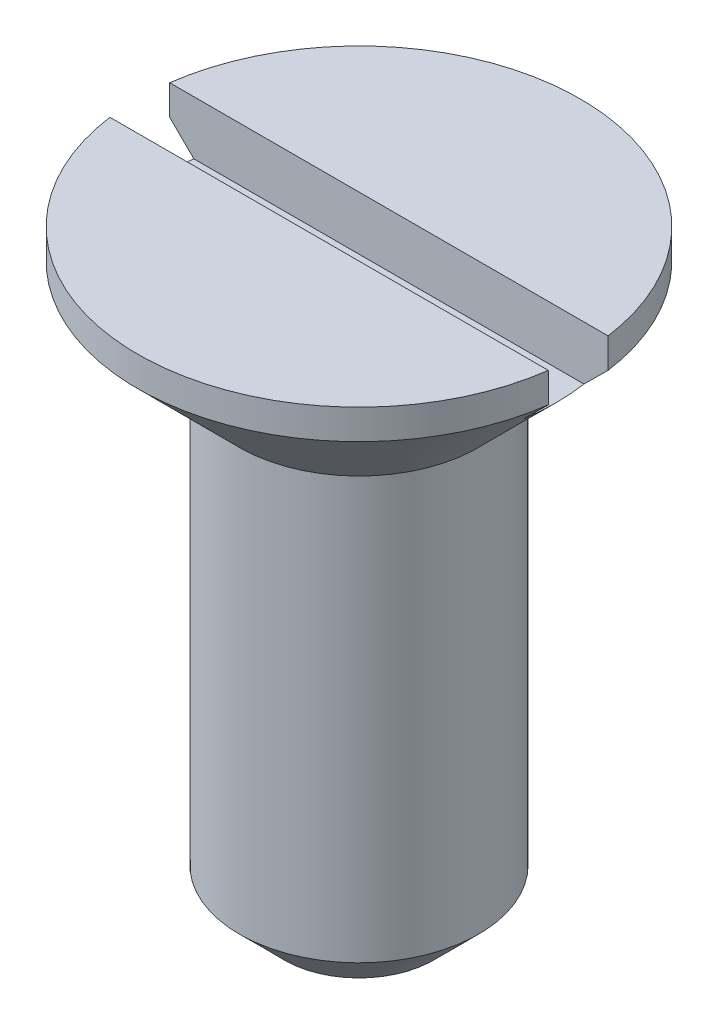
from build123d import *

# Parameters (mm, degrees)
SKETCH_13_W         = 7.4
SKETCH_13_H         = 1
CUT_EXTRUDE_9_DEPTH = 0.9
CHAMFER_1_SIZE      = 0.75


with BuildPart() as part:
    # Эскиз1 → Повернуть1 (revolve)
    with BuildSketch(Plane.XY):
        Polygon((0, 92.035042223), (0, 82.035042223), (2, 82.035042223), (2, 89.835042223), (3.7, 91.535042223), (3.7, 92.035042223), align=None)
    revolve(axis=Axis((0, 125.763182898, 0), (0, -1, 0)))

    # Эскиз13 → Вырез-Вытянуть9 (cut)
    with BuildSketch(Plane(origin=(0, 92.035042223, 0), x_dir=(-1, 0, 0), z_dir=(0, 1, 0))):
        Rectangle(SKETCH_13_W, SKETCH_13_H)
    extrude(amount=-CUT_EXTRUDE_9_DEPTH, mode=Mode.SUBTRACT)

    # Фаска1
    chamfer_1_edges = [part.edges().sort_by_distance(p)[0] for p in [
        (-2, 82.035042223, 0),
    ]]
    chamfer(chamfer_1_edges, length=CHAMFER_1_SIZE)


solid = part.part
